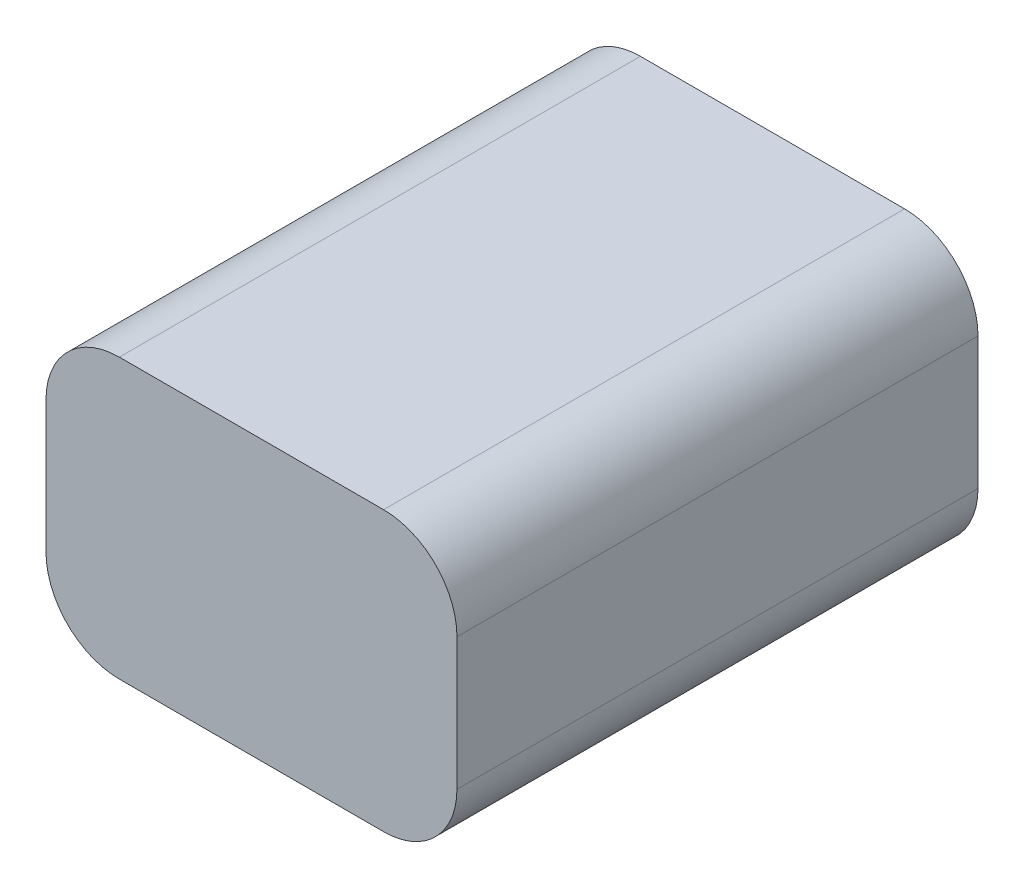
from build123d import *

# Parameters (mm, degrees)
SKETCH_1_W      = 56
SKETCH_1_H      = 38
EXTRUDE_1_DEPTH = 71
FILLET_1_R      = 10


with BuildPart() as part:
    # 草图1 → 凸台-拉伸1 (new body)
    with BuildSketch(Plane.XY):
        with Locations((28, 19)):
            Rectangle(SKETCH_1_W, SKETCH_1_H)
    extrude(amount=EXTRUDE_1_DEPTH)

    # 圆角1
    fillet_1_edges = [part.edges().sort_by_distance(p)[0] for p in [
        (0, 38, 35.5),
        (56, 38, 35.5),
        (56, 0, 35.5),
        (0, 0, 35.5),
    ]]
    fillet(fillet_1_edges, radius=FILLET_1_R)


solid = part.part
